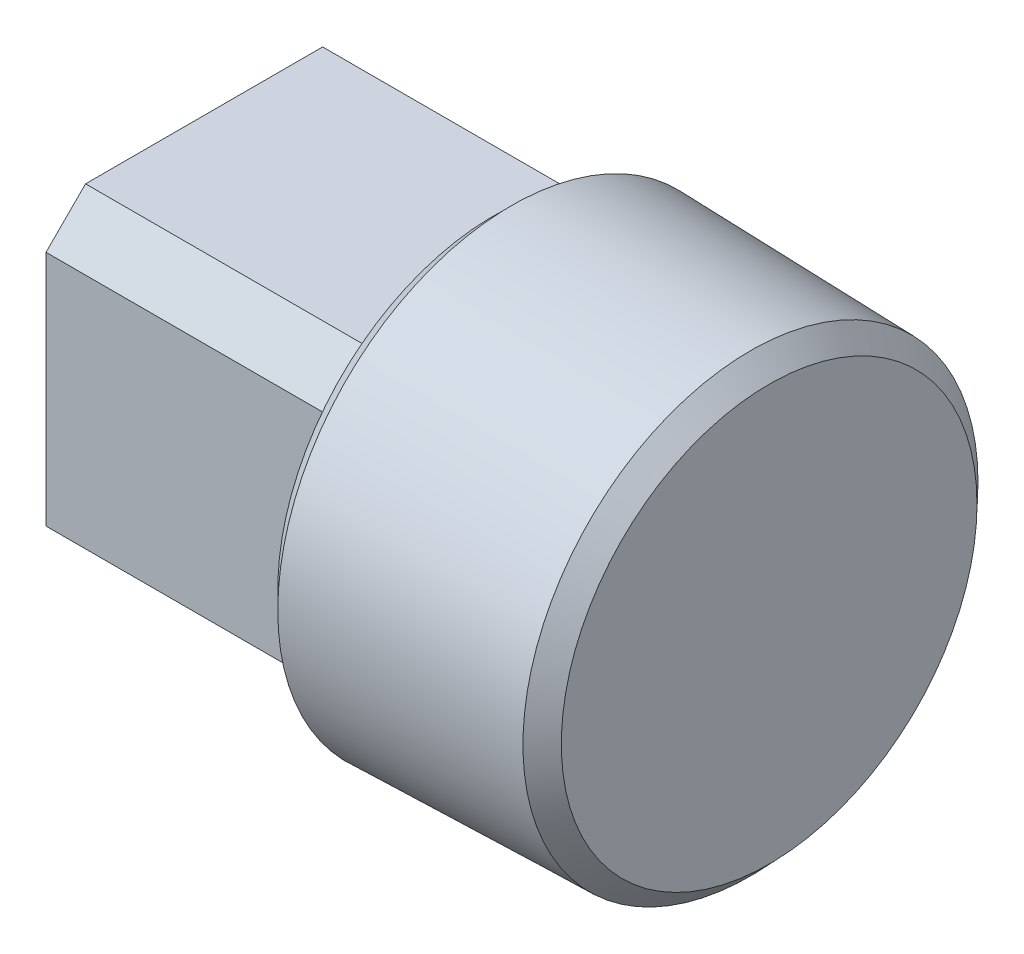
from build123d import *
from OCP.BRepFilletAPI import BRepFilletAPI_MakeChamfer

# Parameters (mm, degrees)
SKETCH2_R          = 8.5725
EXTRUDE1_DEPTH     = 10.414
EXTRUDE1_DRAFT     = 1.5
CHAMFER1_SIZE      = 0.705555556
CHAMFER1_SIZE2     = 0.724776351
CHAMFER1_SIZE2_2   = 0.687787076
SKETCH6_W          = 11.938
SKETCH6_H          = 11.938
EXTRUDE2_DEPTH     = 10.922
CUT_EXTRUDE1_DEPTH = 10.922


with BuildPart() as part:
    # Sketch2 → Extrude1 (with draft: the straight prism first)
    with BuildSketch(Plane(origin=(10.668, 0, 0), x_dir=(0, 0, -1), z_dir=(1, 0, 0))):
        Circle(SKETCH2_R)
    extrude(amount=-EXTRUDE1_DEPTH)
    # Extrude1: the draft: its side faces are tilted about the plane it starts from
    extrude1_sides = [part.faces().sort_by_distance(p)[0] for p in [
        (5.461, 0, 8.5725),
    ]]
    draft(extrude1_sides, Plane(origin=(10.668, 0, 0), x_dir=(0, 0, -1), z_dir=(1, 0, 0)), EXTRUDE1_DRAFT)

    # Chamfer1: one chamfer whose edges measure the first distance from different faces: ONE call of the kernel's chamfer builder (chamfer() names one face for all edges)
    chamfer1_edges_1 = [part.edges().sort_by_distance(p)[0] for p in [
        (10.668, 0, 8.5725),
    ]]
    chamfer1_side_1 = [part.faces().sort_by_distance(p)[0] for p in [
        (5.461, 0, 8.708850094),
    ]]
    chamfer1_edges_2 = [part.edges().sort_by_distance(p)[0] for p in [
        (0.254, 0, 8.845200187),
    ]]
    chamfer1_side_2 = [part.faces().sort_by_distance(p)[0] for p in [
        (0.254, 0, 0),
    ]]
    chamfer1 = BRepFilletAPI_MakeChamfer(part.part.solid().wrapped)
    for e in chamfer1_edges_1:
        chamfer1.Add(CHAMFER1_SIZE, CHAMFER1_SIZE2, e.wrapped, chamfer1_side_1[0].wrapped)  # the first distance lies on this face
    for e in chamfer1_edges_2:
        chamfer1.Add(CHAMFER1_SIZE, CHAMFER1_SIZE2_2, e.wrapped, chamfer1_side_2[0].wrapped)  # the first distance lies on this face
    add(Compound.cast(chamfer1.Shape()), mode=Mode.REPLACE)

    # Sketch6 → Extrude2 (add)
    with BuildSketch(Plane.ZY.offset(-0.254)):
        Rectangle(SKETCH6_W, SKETCH6_H)
    extrude(amount=EXTRUDE2_DEPTH)

    # Sketch7 → Cut-Extrude1 (cut)
    with BuildSketch(Plane.ZY.offset(10.668)):
        Polygon((4.47675, 5.969), (5.969, 4.47675), (5.969, 5.969), align=None)
        Polygon((5.969, -4.47675), (4.47675, -5.969), (5.969, -5.969), align=None)
        Polygon((-5.969, -4.47675), (-4.47675, -5.969), (-5.969, -5.969), align=None)
        Polygon((-5.969, 4.47675), (-4.47675, 5.969), (-5.969, 5.969), align=None)
    extrude(amount=-CUT_EXTRUDE1_DEPTH, mode=Mode.SUBTRACT)


solid = part.part
